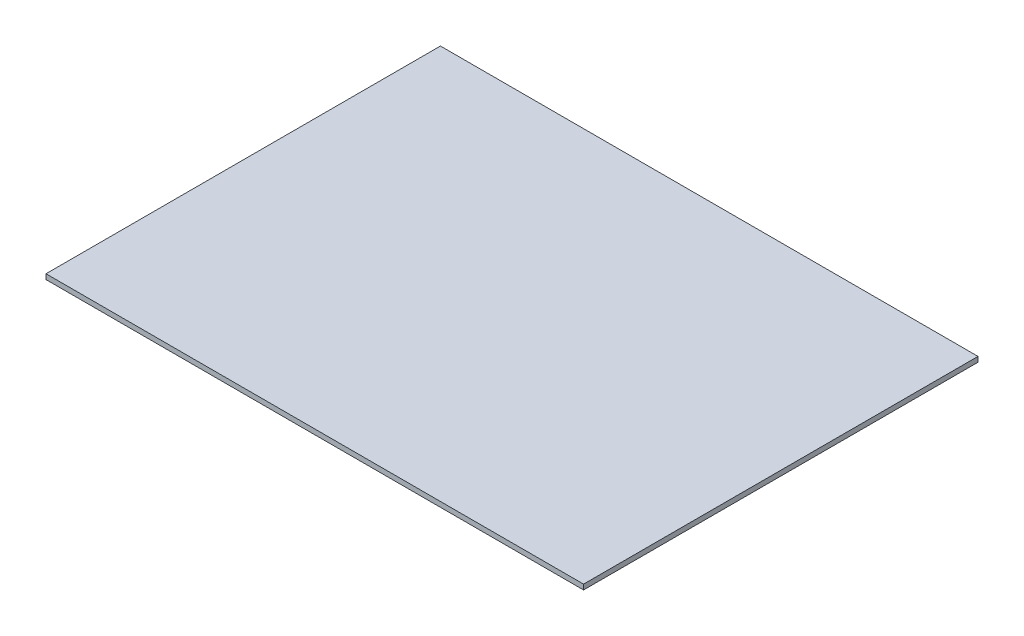
from build123d import *

# Parameters (mm, degrees)
SKETCH1_W           = 167.64
SKETCH1_H           = 123
BOSS_EXTRUDE1_DEPTH = 1.5875


with BuildPart() as part:
    # Sketch1 → Boss-Extrude1 (new body)
    with BuildSketch(Plane(origin=(0, 0, 0), x_dir=(1, 0, 0), z_dir=(0, 1, 0))):
        with Locations((83.82, 61.5)):
            Rectangle(SKETCH1_W, SKETCH1_H)
    extrude(amount=BOSS_EXTRUDE1_DEPTH)


solid = part.part
